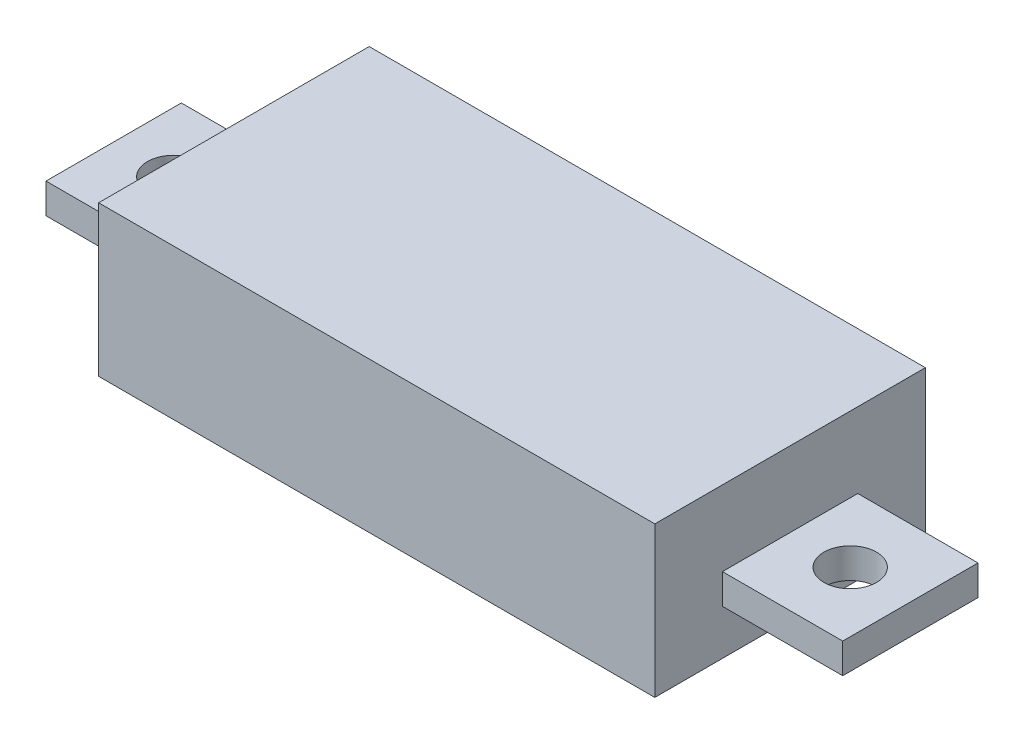
from build123d import *

# Parameters (mm, degrees)
SKETCH_1_W           = 37
SKETCH_1_H           = 18
EXTRUDE_1_DEPTH      = 10
EXTRUDE_2_DEPTH      = 8
EXTRUDE_2_DEPTH_BACK = 45
SKETCH_2_W           = 9
SKETCH_2_H           = 2
SKETCH_3_R           = 1.75
CUT_EXTRUDE_1_DEPTH  = 8


with BuildPart() as part:
    # 草图1 → 凸台-拉伸1 (new body)
    with BuildSketch(Plane(origin=(0, 0, 0), x_dir=(1, 0, 0), z_dir=(0, 1, 0))):
        with Locations((-27.266289308, 19.375099371)):
            Rectangle(SKETCH_1_W, SKETCH_1_H)
    extrude(amount=EXTRUDE_1_DEPTH)

    # 草图2 → 凸台-拉伸2 (add, two sides: drawn at the far end of the back side and taken through both)
    with BuildSketch(Plane.ZY.offset(45.766289308).offset(-EXTRUDE_2_DEPTH_BACK)):
        with Locations((-19.375099371, 4)):
            Rectangle(SKETCH_2_W, SKETCH_2_H)
    extrude(amount=EXTRUDE_2_DEPTH + EXTRUDE_2_DEPTH_BACK)

    # 草图3 → 切除-拉伸1 (cut)
    with BuildSketch(Plane(origin=(0, 5, 0), x_dir=(1, 0, 0), z_dir=(0, 1, 0))):
        with Locations(Location((-49.766289308, 19.375099371, 0), (0, 0, 270))):
            Circle(SKETCH_3_R)
        with Locations(Location((-4.766289308, 19.375099371, 0), (0, 0, 270))):
            Circle(SKETCH_3_R)
    extrude(amount=-CUT_EXTRUDE_1_DEPTH, mode=Mode.SUBTRACT)


solid = part.part
